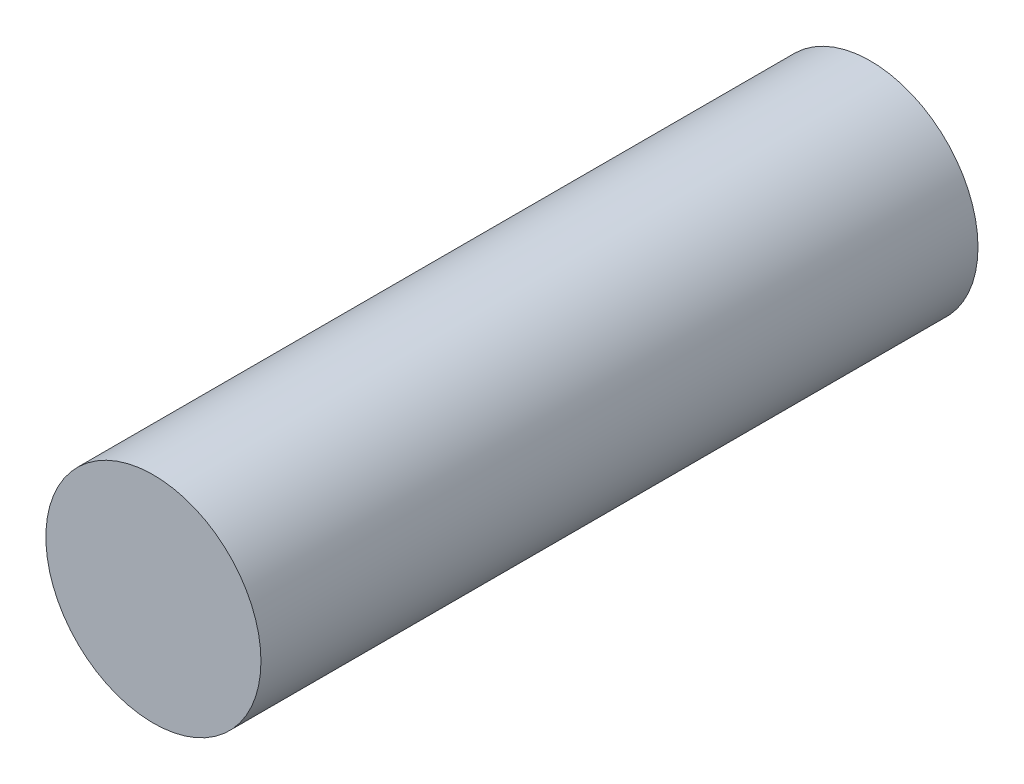
from build123d import *

# Parameters (mm, degrees)
SKETCH1_R           = 15
BOSS_EXTRUDE1_DEPTH = 100


with BuildPart() as part:
    # Sketch1 → Boss-Extrude1 (new body)
    with BuildSketch(Plane.XY):
        Circle(SKETCH1_R)
    extrude(amount=BOSS_EXTRUDE1_DEPTH)


solid = part.part
